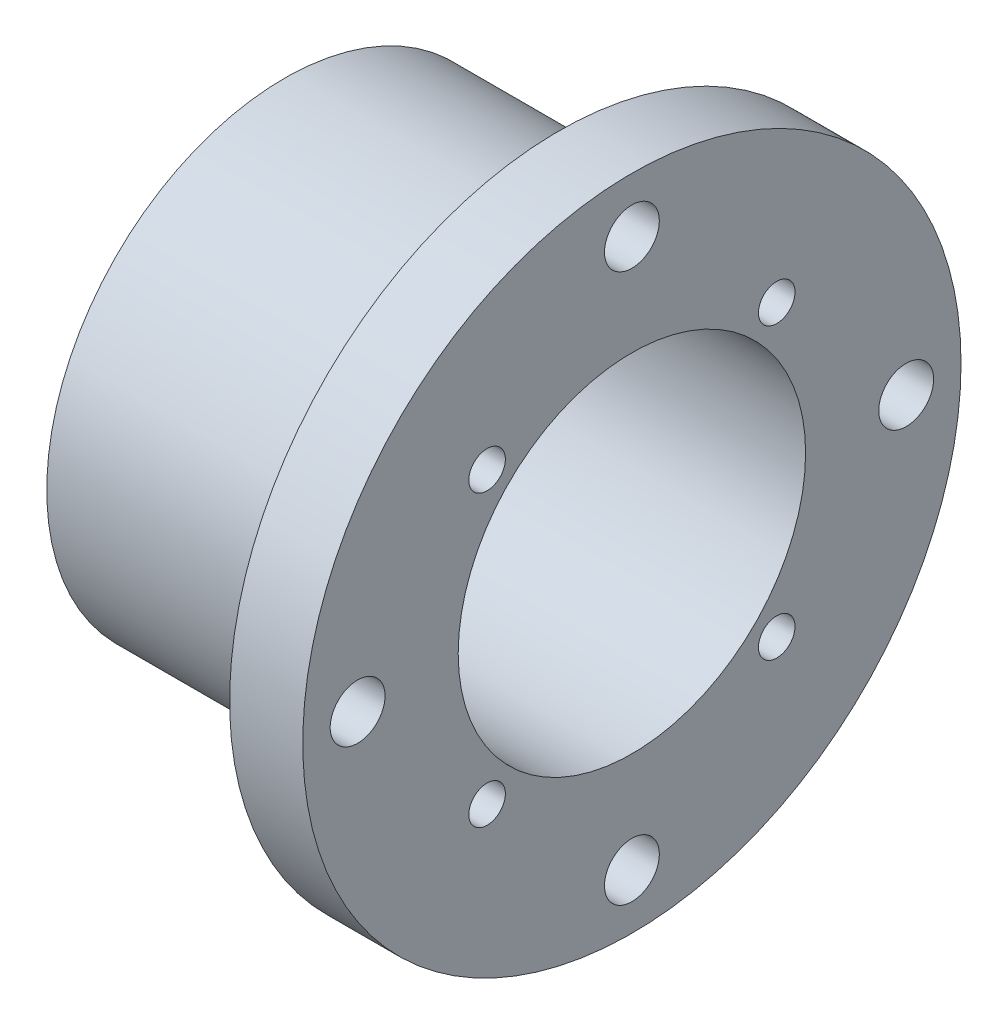
from build123d import *

# Parameters (mm, degrees)
SKETCH1_R           = 13
SKETCH1_R_2         = 9.5
BOSS_EXTRUDE1_DEPTH = 15
SKETCH2_R           = 18
SKETCH2_R_2         = 9.5
BOSS_EXTRUDE2_DEPTH = 4
SKETCH3_R           = 9.5
SKETCH3_R_2         = 8.5
BOSS_EXTRUDE3_DEPTH = 2
SKETCH4_R           = 1.5
CUT_EXTRUDE1_DEPTH  = 32.764760349
SKETCH5_R           = 1
CUT_EXTRUDE2_DEPTH  = 8


with BuildPart() as part:
    # Sketch1 → Boss-Extrude1 (new body)
    with BuildSketch(Plane(origin=(0, 0, 0), x_dir=(0, 0, -1), z_dir=(1, 0, 0))):
        Circle(SKETCH1_R)
        Circle(SKETCH1_R_2, mode=Mode.SUBTRACT)
    extrude(amount=BOSS_EXTRUDE1_DEPTH)

    # Sketch2 → Boss-Extrude2 (add)
    with BuildSketch(Plane(origin=(15, 0, 0), x_dir=(0, 0, -1), z_dir=(1, 0, 0))):
        Circle(SKETCH2_R)
        Circle(SKETCH2_R_2, mode=Mode.SUBTRACT)
    extrude(amount=BOSS_EXTRUDE2_DEPTH)

    # Sketch3 → Boss-Extrude3 (add)
    with BuildSketch(Plane.ZY):
        Circle(SKETCH3_R)
        Circle(SKETCH3_R_2, mode=Mode.SUBTRACT)
    extrude(amount=-BOSS_EXTRUDE3_DEPTH)

    # Sketch4 → Cut-Extrude1 (cut, through all)
    with BuildSketch(Plane(origin=(19, 0, 0), x_dir=(0, 0, -1), z_dir=(1, 0, 0))):
        with Locations((0, 15)):
            Circle(SKETCH4_R)
        with Locations((15, 0)):
            Circle(SKETCH4_R)
        with Locations((0, -15)):
            Circle(SKETCH4_R)
        with Locations((-15, 0)):
            Circle(SKETCH4_R)
    extrude(amount=-CUT_EXTRUDE1_DEPTH, mode=Mode.SUBTRACT)

    # Sketch5 → Cut-Extrude2 (cut)
    with BuildSketch(Plane(origin=(19, 0, 0), x_dir=(0, 0, -1), z_dir=(1, 0, 0))):
        with Locations((7.919595949, 7.919595949)):
            Circle(SKETCH5_R)
        with Locations((7.919595949, -7.919595949)):
            Circle(SKETCH5_R)
        with Locations((-7.919595949, -7.919595949)):
            Circle(SKETCH5_R)
        with Locations((-7.919595949, 7.919595949)):
            Circle(SKETCH5_R)
    extrude(amount=-CUT_EXTRUDE2_DEPTH, mode=Mode.SUBTRACT)


solid = part.part
